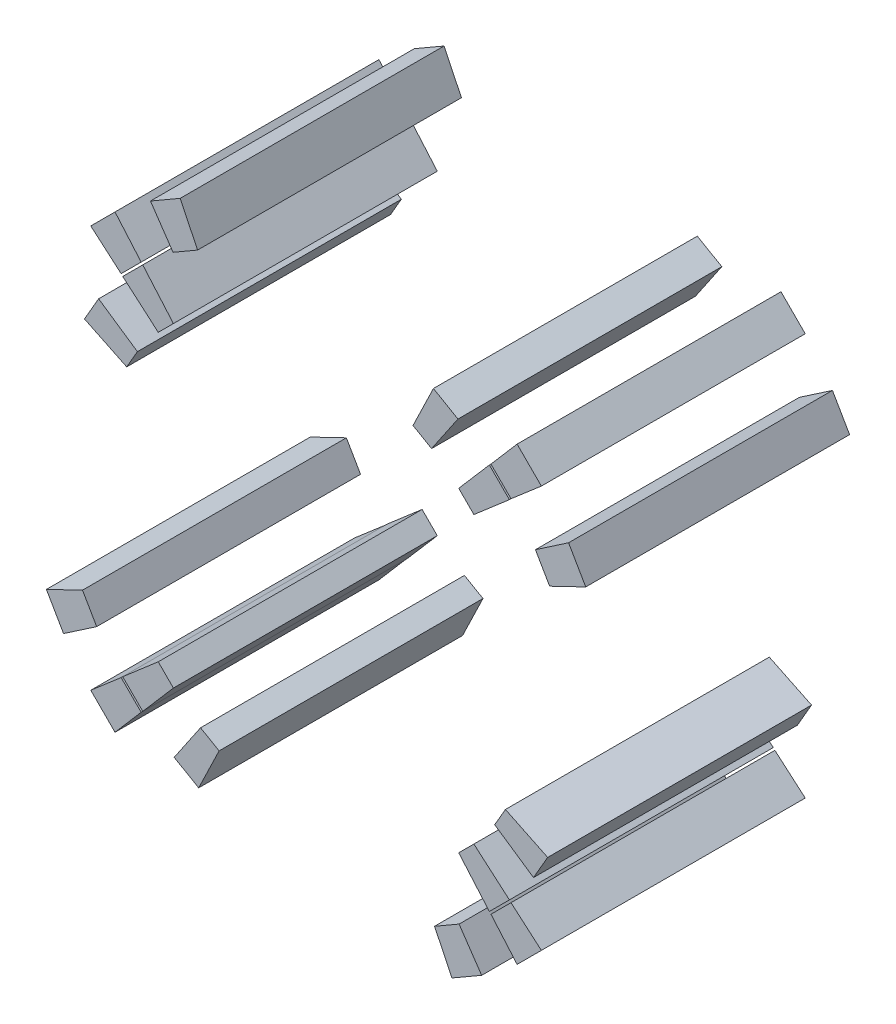
from build123d import *

# Parameters (mm, degrees)
COIL_SIDES_START    = -20
COIL_SIDES_DEPTH    = 40
COIL_SIDES_2_DEPTH  = 40
COIL_SIDES_3_DEPTH  = 40
COIL_SIDES_4_DEPTH  = 40
COIL_SIDES_5_DEPTH  = 40
COIL_SIDES_6_DEPTH  = 40
COIL_SIDES_7_DEPTH  = 40
COIL_SIDES_8_DEPTH  = 40
COIL_SIDES_9_DEPTH  = 40
COIL_SIDES_10_DEPTH = 40
COIL_SIDES_11_DEPTH = 40
COIL_SIDES_12_DEPTH = 40
COIL_SIDES_13_DEPTH = 40
COIL_SIDES_14_DEPTH = 40
COIL_SIDES_15_DEPTH = 40
COIL_SIDES_16_DEPTH = 40


with BuildPart() as part:
    # Эскиз1 → Coil_sides (new body)
    with BuildSketch(Plane.XY.offset(COIL_SIDES_START)):
        Polygon((35.404539789, 17.961307368), (40.877360953, 20.59833395), (38.277360953, 25.10166605), (33.25721836, 21.680577182), align=None)
    extrude(amount=COIL_SIDES_DEPTH)


with BuildPart() as body_2:
    # Эскиз1 → Coil_sides 2 (new body)
    with BuildSketch(Plane.XY.offset(COIL_SIDES_START)):
        Polygon((23.924274918, 21.626177879), (29.307682044, 26.270910957), (26.270910957, 29.307682044), (21.626177879, 23.924274918), align=None)
    extrude(amount=COIL_SIDES_2_DEPTH)


with BuildPart() as body_3:
    # Эскиз1 → Coil_sides 3 (new body)
    with BuildSketch(Plane.XY.offset(COIL_SIDES_START)):
        Polygon((29.549430928, 26.512659841), (34.153257531, 30.476302269), (30.476302269, 34.153257531), (26.512659841, 29.549430928), align=None)
    extrude(amount=COIL_SIDES_3_DEPTH)


with BuildPart() as body_4:
    # Эскиз1 → Coil_sides 4 (new body)
    with BuildSketch(Plane.XY.offset(COIL_SIDES_START)):
        Polygon((17.511808311, 27.081341726), (21.509634907, 32.961137654), (17.790365093, 35.108459083), (14.697225748, 28.706341726), align=None)
    extrude(amount=COIL_SIDES_4_DEPTH)


with BuildPart() as body_5:
    # Эскиз1 → Coil_sides 5 (new body)
    with BuildSketch(Plane.XY.offset(COIL_SIDES_START)):
        Polygon((-17.961307368, 35.404539789), (-20.59833395, 40.877360953), (-25.10166605, 38.277360953), (-21.680577182, 33.25721836), align=None)
    extrude(amount=COIL_SIDES_5_DEPTH)


with BuildPart() as body_6:
    # Эскиз1 → Coil_sides 6 (new body)
    with BuildSketch(Plane.XY.offset(COIL_SIDES_START)):
        Polygon((-21.626177879, 23.924274918), (-26.270910957, 29.307682044), (-29.307682044, 26.270910957), (-23.924274918, 21.626177879), align=None)
    extrude(amount=COIL_SIDES_6_DEPTH)


with BuildPart() as body_7:
    # Эскиз1 → Coil_sides 7 (new body)
    with BuildSketch(Plane.XY.offset(COIL_SIDES_START)):
        Polygon((-26.512659841, 29.549430928), (-30.476302269, 34.153257531), (-34.153257531, 30.476302269), (-29.549430928, 26.512659841), align=None)
    extrude(amount=COIL_SIDES_7_DEPTH)


with BuildPart() as body_8:
    # Эскиз1 → Coil_sides 8 (new body)
    with BuildSketch(Plane.XY.offset(COIL_SIDES_START)):
        Polygon((-27.081341726, 17.511808311), (-32.961137654, 21.509634907), (-35.108459083, 17.790365093), (-28.706341726, 14.697225748), align=None)
    extrude(amount=COIL_SIDES_8_DEPTH)


with BuildPart() as body_9:
    # Эскиз1 → Coil_sides 9 (new body)
    with BuildSketch(Plane.XY.offset(COIL_SIDES_START)):
        Polygon((-35.404539789, -17.961307368), (-40.877360953, -20.59833395), (-38.277360953, -25.10166605), (-33.25721836, -21.680577182), align=None)
    extrude(amount=COIL_SIDES_9_DEPTH)


with BuildPart() as body_10:
    # Эскиз1 → Coil_sides 10 (new body)
    with BuildSketch(Plane.XY.offset(COIL_SIDES_START)):
        Polygon((-23.924274918, -21.626177879), (-29.307682044, -26.270910957), (-26.270910957, -29.307682044), (-21.626177879, -23.924274918), align=None)
    extrude(amount=COIL_SIDES_10_DEPTH)


with BuildPart() as body_11:
    # Эскиз1 → Coil_sides 11 (new body)
    with BuildSketch(Plane.XY.offset(COIL_SIDES_START)):
        Polygon((-29.549430928, -26.512659841), (-34.153257531, -30.476302269), (-30.476302269, -34.153257531), (-26.512659841, -29.549430928), align=None)
    extrude(amount=COIL_SIDES_11_DEPTH)


with BuildPart() as body_12:
    # Эскиз1 → Coil_sides 12 (new body)
    with BuildSketch(Plane.XY.offset(COIL_SIDES_START)):
        Polygon((-17.511808311, -27.081341726), (-21.509634907, -32.961137654), (-17.790365093, -35.108459083), (-14.697225748, -28.706341726), align=None)
    extrude(amount=COIL_SIDES_12_DEPTH)


with BuildPart() as body_13:
    # Эскиз1 → Coil_sides 13 (new body)
    with BuildSketch(Plane.XY.offset(COIL_SIDES_START)):
        Polygon((17.961307368, -35.404539789), (20.59833395, -40.877360953), (25.10166605, -38.277360953), (21.680577182, -33.25721836), align=None)
    extrude(amount=COIL_SIDES_13_DEPTH)


with BuildPart() as body_14:
    # Эскиз1 → Coil_sides 14 (new body)
    with BuildSketch(Plane.XY.offset(COIL_SIDES_START)):
        Polygon((21.626177879, -23.924274918), (26.270910957, -29.307682044), (29.307682044, -26.270910957), (23.924274918, -21.626177879), align=None)
    extrude(amount=COIL_SIDES_14_DEPTH)


with BuildPart() as body_15:
    # Эскиз1 → Coil_sides 15 (new body)
    with BuildSketch(Plane.XY.offset(COIL_SIDES_START)):
        Polygon((26.512659841, -29.549430928), (30.476302269, -34.153257531), (34.153257531, -30.476302269), (29.549430928, -26.512659841), align=None)
    extrude(amount=COIL_SIDES_15_DEPTH)


with BuildPart() as body_16:
    # Эскиз1 → Coil_sides 16 (new body)
    with BuildSketch(Plane.XY.offset(COIL_SIDES_START)):
        Polygon((27.081341726, -17.511808311), (32.961137654, -21.509634907), (35.108459083, -17.790365093), (28.706341726, -14.697225748), align=None)
    extrude(amount=COIL_SIDES_16_DEPTH)


solid = Compound([part.part, body_2.part, body_3.part, body_4.part, body_5.part, body_6.part, body_7.part, body_8.part, body_9.part, body_10.part, body_11.part, body_12.part, body_13.part, body_14.part, body_15.part, body_16.part])
